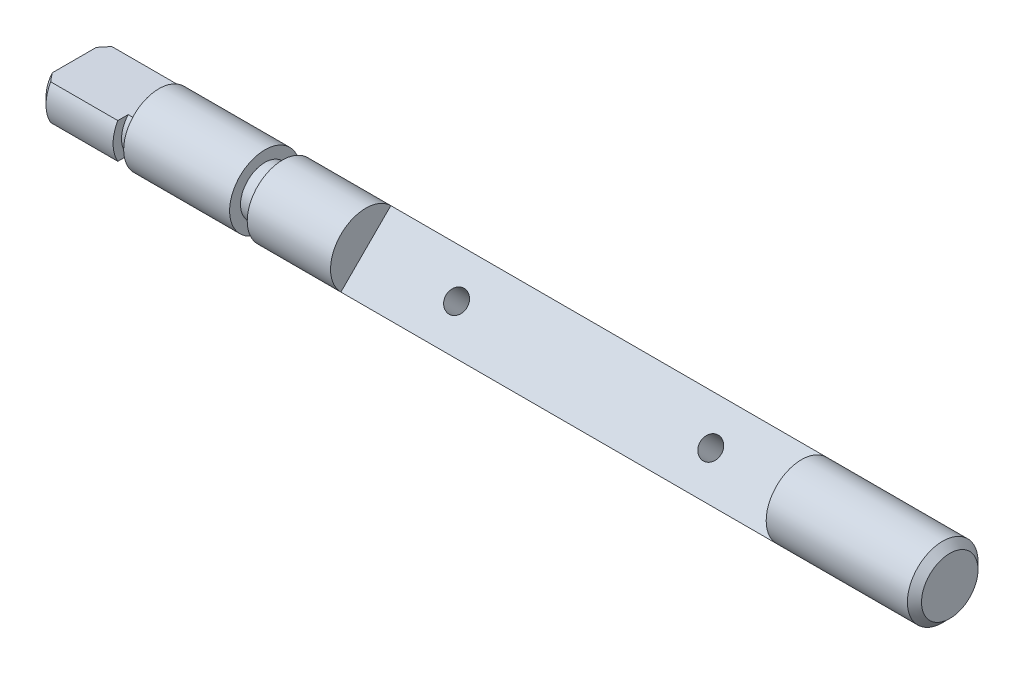
from build123d import *

# Parameters (mm, degrees)
SKETCH1_R            = 5
BOSS_EXTRUDE1_DEPTH  = 21
CHAMFER1_SIZE        = 1
BOSS_EXTRUDE2_START  = 61.7
BOSS_EXTRUDE2_DEPTH  = 61.7
BOSS_EXTRUDE5_START  = 11.8
SKETCH3_R            = 5
BOSS_EXTRUDE5_DEPTH  = 11.8
SKETCH5_R            = 3.45
BOSS_EXTRUDE6_DEPTH  = 2.5
BOSS_EXTRUDE7_START  = 15
SKETCH6_R            = 5
BOSS_EXTRUDE7_DEPTH  = 15
BOSS_EXTRUDE8_DEPTH  = 1.5
BOSS_EXTRUDE10_START = 10.5
SKETCH9_R            = 5
BOSS_EXTRUDE10_DEPTH = 10.5
CHAMFER3_SIZE        = 1
CUT_EXTRUDE1_DEPTH   = 10.5
SKETCH11_R           = 1.5
CUT_EXTRUDE2_DEPTH   = 10.5


with BuildPart() as part:
    # Sketch1 → Boss-Extrude1 (new body)
    with BuildSketch(Plane(origin=(0, 0, 0), x_dir=(0, 0, -1), z_dir=(1, 0, 0))):
        with Locations(Location((0, 0, 0), (0, 0, 180))):
            Circle(SKETCH1_R)
    extrude(amount=BOSS_EXTRUDE1_DEPTH)

    # Chamfer1
    chamfer1_edges = [part.edges().sort_by_distance(p)[0] for p in [
        (21, 0, -5),
    ]]
    chamfer(chamfer1_edges, length=CHAMFER1_SIZE)

    # Sketch2 → Boss-Extrude2 (add)
    with BuildSketch(Plane.ZY.offset(BOSS_EXTRUDE2_START)):
        with BuildLine():
            Line((-3.535533906, 3.535533906), (3.535533906, -3.535533906))
            ThreePointArc((3.535533906, -3.535533906), (-3.535533906, -3.535533906), (-3.535533906, 3.535533906))
        make_face()
    extrude(amount=-BOSS_EXTRUDE2_DEPTH)

    # Sketch3 → Boss-Extrude5 (add)
    with BuildSketch(Plane.ZY.offset(61.7).offset(BOSS_EXTRUDE5_START)):
        Circle(SKETCH3_R)
    extrude(amount=-BOSS_EXTRUDE5_DEPTH)

    # Sketch5 → Boss-Extrude6 (add)
    with BuildSketch(Plane.ZY.offset(73.5)):
        Circle(SKETCH5_R)
    extrude(amount=BOSS_EXTRUDE6_DEPTH)

    # Sketch6 → Boss-Extrude7 (add)
    with BuildSketch(Plane.ZY.offset(76).offset(BOSS_EXTRUDE7_START)):
        Circle(SKETCH6_R)
    extrude(amount=-BOSS_EXTRUDE7_DEPTH)

    # Sketch7 → Boss-Extrude8 (add)
    with BuildSketch(Plane.ZY.offset(91)):
        with BuildLine():
            Line((-2.861817604, 2.5), (2.861817604, 2.5))
            ThreePointArc((2.861817604, 2.5), (3.8, 0), (2.861817604, -2.5))
            Line((2.861817604, -2.5), (-2.861817604, -2.5))
            ThreePointArc((-2.861817604, -2.5), (-3.8, 0), (-2.861817604, 2.5))
        make_face()
    extrude(amount=BOSS_EXTRUDE8_DEPTH)

    # Sketch9 → Boss-Extrude10 (add)
    with BuildSketch(Plane.ZY.offset(92.5).offset(BOSS_EXTRUDE10_START)):
        Circle(SKETCH9_R)
    extrude(amount=-BOSS_EXTRUDE10_DEPTH)

    # Chamfer3
    chamfer3_edges = [part.edges().sort_by_distance(p)[0] for p in [
        (-103, 0, -5),
    ]]
    chamfer(chamfer3_edges, length=CHAMFER3_SIZE)

    # Sketch10 → Cut-Extrude1 (cut)
    with BuildSketch(Plane.ZY.offset(103)):
        with BuildLine():
            Line((-4.330127019, 2.5), (4.330127019, 2.5))
            ThreePointArc((4.330127019, 2.5), (0, 5), (-4.330127019, 2.5))
        make_face()
        with BuildLine():
            Line((-4.330127019, -2.5), (4.330127019, -2.5))
            ThreePointArc((4.330127019, -2.5), (0, -5), (-4.330127019, -2.5))
        make_face()
    extrude(amount=-CUT_EXTRUDE1_DEPTH, mode=Mode.SUBTRACT)

    # Sketch11 → Cut-Extrude2 (cut)
    with BuildSketch(Plane(origin=(0, 0, 0), x_dir=(1, 0, 0), z_dir=(0, 0.7071067811865468, 0.7071067811865483))):
        with Locations(Location((-12.85, 0, 0), (0, 0, 270))):
            Circle(SKETCH11_R)
        with Locations(Location((-48.85, 0, 0), (0, 0, 270))):
            Circle(SKETCH11_R)
    extrude(amount=-CUT_EXTRUDE2_DEPTH, mode=Mode.SUBTRACT)


solid = part.part
